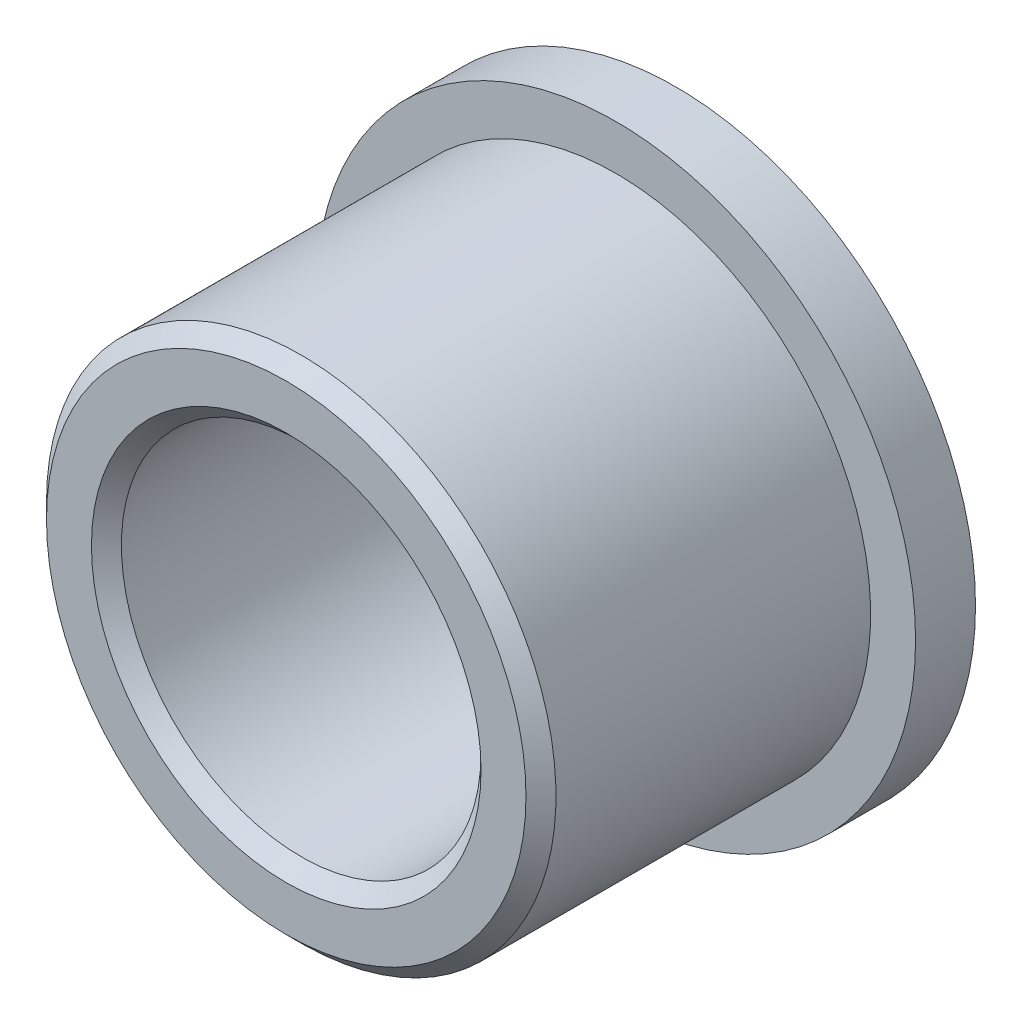
from build123d import *

# Parameters (mm, degrees)
SKETCH_1_R          = 10
EXTRUDE_1_DEPTH     = 2
SKETCH_2_R          = 8.5
EXTRUDE_2_DEPTH     = 13
SKETCH_3_R          = 6
CUT_EXTRUDE_1_DEPTH = 20.209372712
CHAMFER_1_SIZE      = 0.5


with BuildPart() as part:
    # 草图1 → 凸台-拉伸1 (new body)
    with BuildSketch(Plane.XY):
        Circle(SKETCH_1_R)
    extrude(amount=EXTRUDE_1_DEPTH)

    # 草图2 → 凸台-拉伸2 (add)
    with BuildSketch(Plane.XY):
        with Locations(Location((0, 0, 0), (0, 0, 180))):
            Circle(SKETCH_2_R)
    extrude(amount=EXTRUDE_2_DEPTH)

    # 草图3 → 切除-拉伸1 (cut, through all)
    with BuildSketch(Plane.XY.offset(13)):
        Circle(SKETCH_3_R)
    extrude(amount=-CUT_EXTRUDE_1_DEPTH, mode=Mode.SUBTRACT)

    # 倒角1
    chamfer_1_edges = [part.edges().sort_by_distance(p)[0] for p in [
        (-6, 0, 0),
        (-6, 0, 13),
        (8.5, 0, 13),
    ]]
    chamfer(chamfer_1_edges, length=CHAMFER_1_SIZE)


solid = part.part
